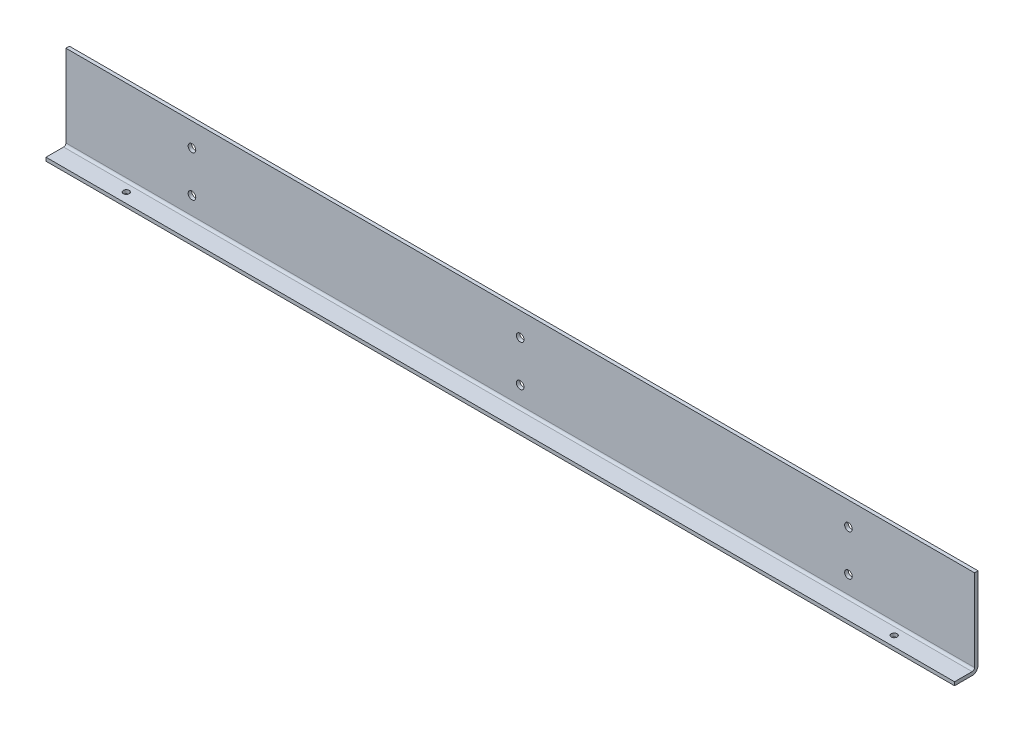
from build123d import *

# Parameters (mm, degrees)
SKETCH_1_W          = 775
SKETCH_1_H          = 75
EXTRUDE_1_DEPTH     = 3
EXTRUDE_START       = -3
SKETCH_2_W          = 775
SKETCH_2_H          = 3
EXTRUDE_2_DEPTH     = 20
SKETCH_3_R          = 3.25
CUT_EXTRUDE_1_DEPTH = 779.806137623
FILLET_1_R          = 5
SKETCH_4_R          = 2.5
CUT_EXTRUDE_2_DEPTH = 779.594246061
FILLET_2_R          = 2


with BuildPart() as part:
    # 스케치1 → 보스-돌출1 (new body)
    with BuildSketch(Plane.XY):
        with Locations((387.5, 37.5)):
            Rectangle(SKETCH_1_W, SKETCH_1_H)
    extrude(amount=EXTRUDE_1_DEPTH)

    # 스케치2 → 보스-돌출2 (add)
    with BuildSketch(Plane.XY.offset(3).offset(EXTRUDE_START)):
        with Locations((387.5, 1.5)):
            Rectangle(SKETCH_2_W, SKETCH_2_H)
    extrude(amount=EXTRUDE_2_DEPTH)

    # 스케치3 → 컷-돌출1 (cut, through all)
    with BuildSketch(Plane.XY.offset(3)):
        with Locations((107.5, 55)):
            Circle(SKETCH_3_R)
        with Locations((107.5, 20)):
            Circle(SKETCH_3_R)
        with Locations((387.5, 55)):
            Circle(SKETCH_3_R)
        with Locations((387.5, 20)):
            Circle(SKETCH_3_R)
        with Locations((667.5, 55)):
            Circle(SKETCH_3_R)
        with Locations((667.5, 20)):
            Circle(SKETCH_3_R)
    extrude(amount=-CUT_EXTRUDE_1_DEPTH, mode=Mode.SUBTRACT)

    # 필렛1
    fillet_1_edges = [part.edges().sort_by_distance(p)[0] for p in [
        (387.5, 0, 0),
    ]]
    fillet(fillet_1_edges, radius=FILLET_1_R)

    # 스케치4 → 컷-돌출2 (cut, through all)
    with BuildSketch(Plane(origin=(0, 3, 0), x_dir=(1, 0, 0), z_dir=(0, 1, 0))):
        with Locations(Location((60, -11.5, 0), (0, 0, 270))):
            Circle(SKETCH_4_R)
        with Locations(Location((715, -11.5, 0), (0, 0, 270))):
            Circle(SKETCH_4_R)
    extrude(amount=-CUT_EXTRUDE_2_DEPTH, mode=Mode.SUBTRACT)

    # 필렛2
    fillet_2_edges = [part.edges().sort_by_distance(p)[0] for p in [
        (387.5, 3, 3),
    ]]
    fillet(fillet_2_edges, radius=FILLET_2_R)


solid = part.part
